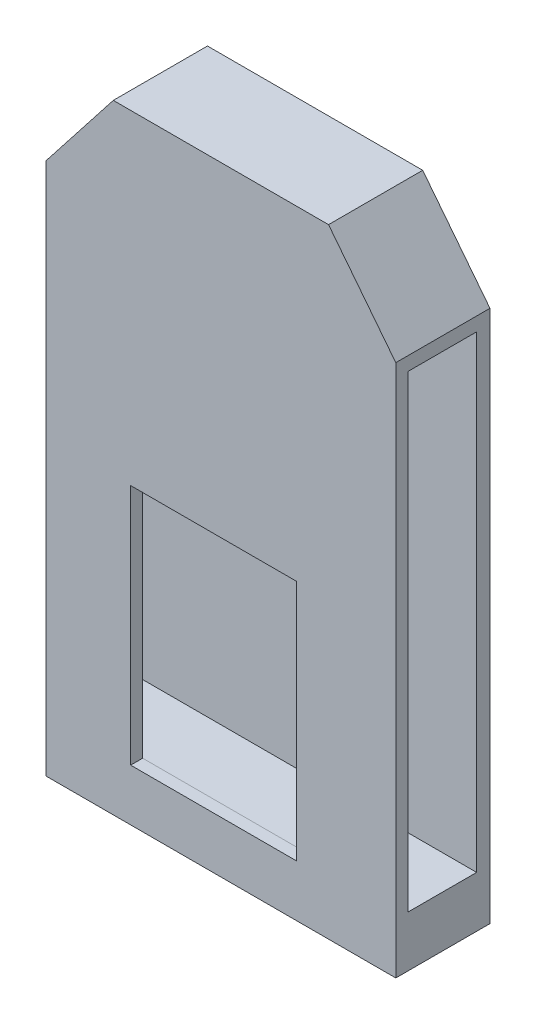
from build123d import *

# Parameters (mm, degrees)
BOSS_EXTRUDE1_DEPTH = 70
SKETCH2_W           = 123.25
SKETCH2_H           = 180
CUT_EXTRUDE1_DEPTH  = 60
SKETCH3_W           = 116.2609192
SKETCH3_H           = 54.96046542
CUT_EXTRUDE2_DEPTH  = 232
SKETCH4_W           = 51.18
SKETCH4_H           = 348.03
CUT_EXTRUDE3_DEPTH  = 260


with BuildPart() as part:
    # Sketch1 → Boss-Extrude1 (new body)
    with BuildSketch(Plane.XY):
        Polygon((130, -230), (-130, -230), (-130, 166.14), (-80, 230), (80, 230), (130, 166.14), align=None)
    extrude(amount=BOSS_EXTRUDE1_DEPTH)

    # Sketch2 → Cut-Extrude1 (cut)
    with BuildSketch(Plane.XY.offset(70)):
        with Locations((-5.475, -101.52)):
            Rectangle(SKETCH2_W, SKETCH2_H)
    extrude(amount=-CUT_EXTRUDE1_DEPTH, mode=Mode.SUBTRACT)

    # Sketch3 → Cut-Extrude2 (cut)
    with BuildSketch(Plane.XZ.offset(11.52)):
        with Locations((-5.475, 40)):
            Rectangle(SKETCH3_W, SKETCH3_H)
    extrude(amount=-CUT_EXTRUDE2_DEPTH, mode=Mode.SUBTRACT)

    # Sketch4 → Cut-Extrude3 (cut)
    with BuildSketch(Plane.ZY.offset(130)):
        with Locations((35.48, -18.055)):
            Rectangle(SKETCH4_W, SKETCH4_H)
    extrude(amount=-CUT_EXTRUDE3_DEPTH, mode=Mode.SUBTRACT)


solid = part.part
